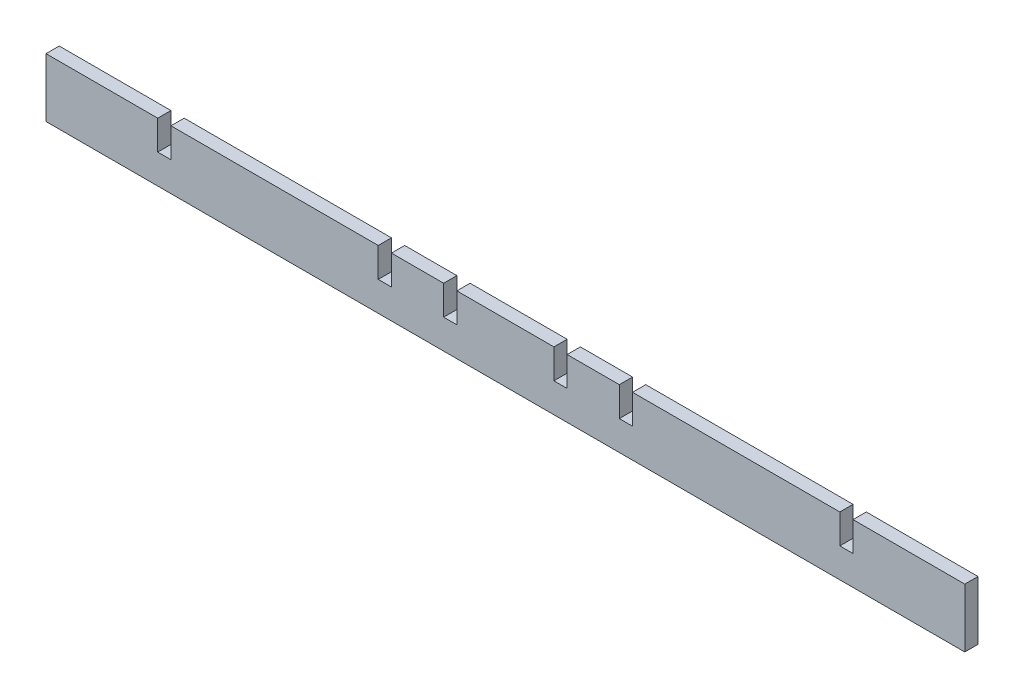
from build123d import *

# Parameters (mm, degrees)
BOSS_EXTRUDE1_DEPTH = 18


with BuildPart() as part:
    # Sketch1 → Boss-Extrude1 (new body)
    with BuildSketch(Plane.XY):
        Polygon((-625, 40), (-625, -40), (625, -40), (625, 40), (473, 40), (473, 0), (455, 0), (455, 40), (173, 40), (173, 0), (155, 0), (155, 40), (84, 40), (84, 0), (66, 0), (66, 40), (-66, 40), (-66, 0), (-84, 0), (-84, 40), (-155, 40), (-155, 0), (-173, 0), (-173, 40), (-455, 40), (-455, 0), (-473, 0), (-473, 40), align=None)
    extrude(amount=BOSS_EXTRUDE1_DEPTH)


solid = part.part
